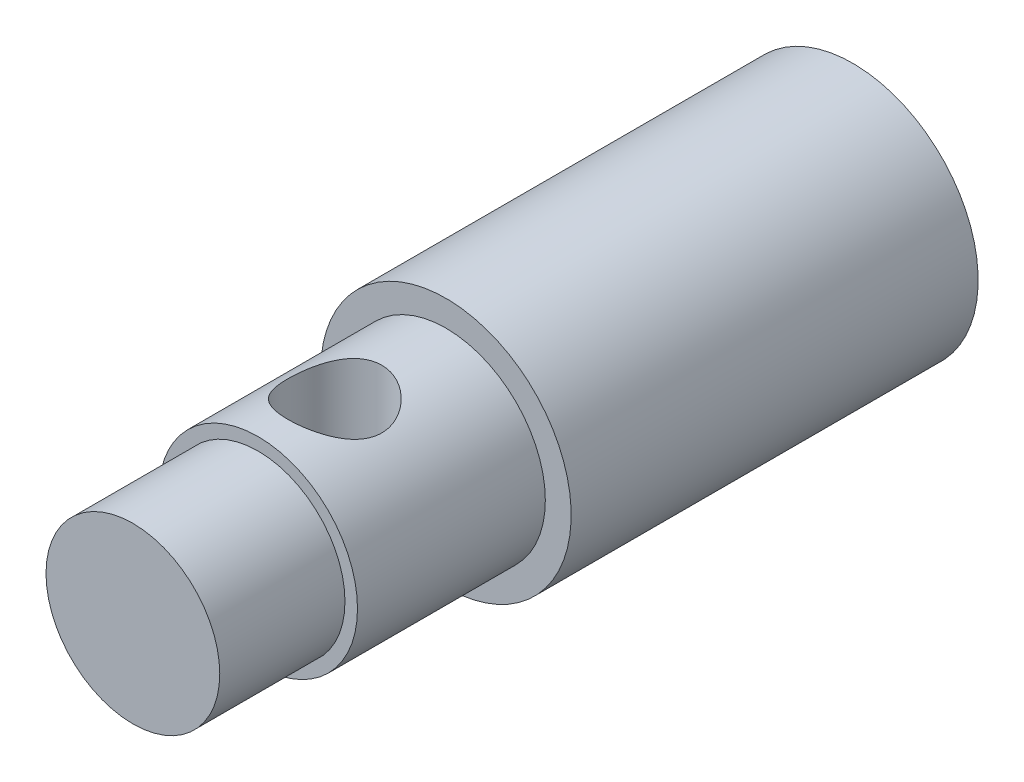
from build123d import *

# Parameters (mm, degrees)
SKETCH1_R               = 4
BOSS_EXTRUDE2_DEPTH     = 13
SKETCH2_R               = 3.175
BOSS_EXTRUDE3_DEPTH     = 6
SKETCH3_R               = 2.775
BOSS_EXTRUDE4_DEPTH     = 4
CUT_EXTRUDE1_DEPTH      = 24.685438565
CUT_EXTRUDE1_DEPTH_BACK = 24.685438565
SKETCH4_R               = 1.5


with BuildPart() as part:
    # Sketch1 → Boss-Extrude2 (new body)
    with BuildSketch(Plane.XY):
        with Locations(Location((0, 0, 0), (0, 0, 180))):
            Circle(SKETCH1_R)
    extrude(amount=BOSS_EXTRUDE2_DEPTH)

    # Sketch2 → Boss-Extrude3 (add)
    with BuildSketch(Plane.XY.offset(13)):
        Circle(SKETCH2_R)
    extrude(amount=BOSS_EXTRUDE3_DEPTH)

    # Sketch3 → Boss-Extrude4 (add)
    with BuildSketch(Plane.XY.offset(19)):
        Circle(SKETCH3_R)
    extrude(amount=BOSS_EXTRUDE4_DEPTH)

    # Sketch4 → Cut-Extrude1 (cut, two sides: drawn at the far end of the back side and taken through both)
    with BuildSketch(Plane(origin=(0, 0, 0), x_dir=(1, 0, 0), z_dir=(0, 1, 0)).offset(-CUT_EXTRUDE1_DEPTH_BACK)):
        with Locations(Location((0, -16.55, 0), (0, 0, 270))):
            Circle(SKETCH4_R)
    extrude(amount=CUT_EXTRUDE1_DEPTH + CUT_EXTRUDE1_DEPTH_BACK, mode=Mode.SUBTRACT)


solid = part.part
